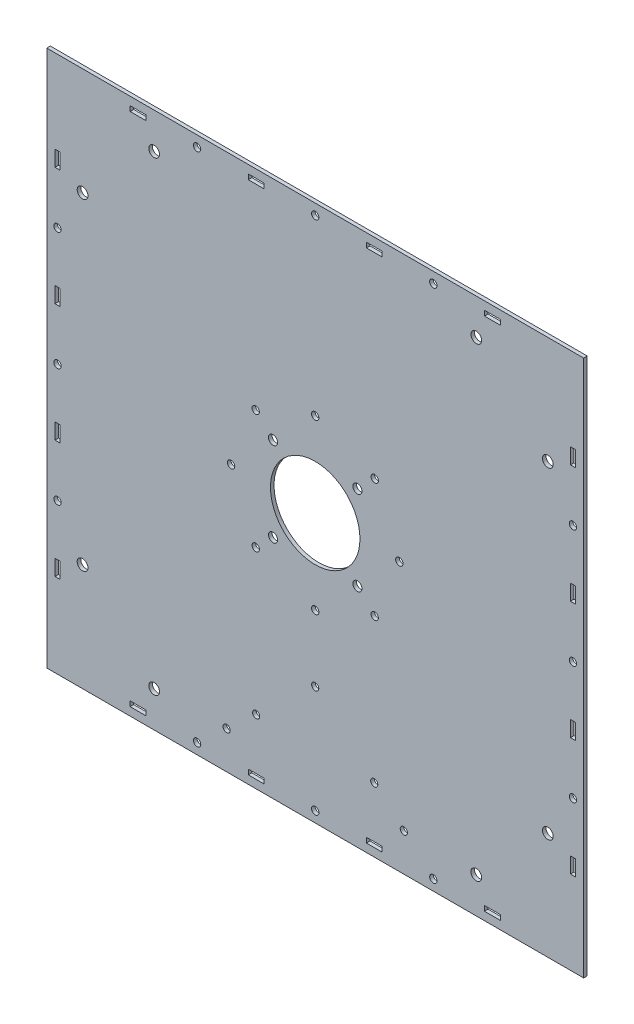
from build123d import *

# Parameters (mm, degrees)
SKETCH_1_R          = 25
SKETCH_1_R_2        = 2.55
EXTRUDE_1_DEPTH     = 2
SKETCH_3_R          = 2.05
SKETCH_3_R_2        = 2
SKETCH_3_W          = 8.8
SKETCH_3_H          = 2.8
SKETCH_3_W_2        = 2.8
SKETCH_3_H_2        = 8.8
CUT_EXTRUDE_2_DEPTH = 4
SKETCH_7_R          = 3
CUT_EXTRUDE_3_DEPTH = 10


with BuildPart() as part:
    # 草图1 → 凸台-拉伸1 (new body)
    with BuildSketch(Plane.XY):
        Polygon((151.457142857, -41.187142857), (151.457142857, 108.812857143), (-148.542857143, 108.812857143), (-148.542857143, -191.187142857), (151.457142857, -191.187142857), align=None)
        with Locations((1.457142857, -41.187142857)):
            Circle(SKETCH_1_R, mode=Mode.SUBTRACT)
        with Locations((25.027142857, -17.617142857)):
            Circle(SKETCH_1_R_2, mode=Mode.SUBTRACT)
        with Locations((25.027142857, -64.757142857)):
            Circle(SKETCH_1_R_2, mode=Mode.SUBTRACT)
        with Locations((-22.112857143, -64.757142857)):
            Circle(SKETCH_1_R_2, mode=Mode.SUBTRACT)
        with Locations((-22.112857143, -17.617142857)):
            Circle(SKETCH_1_R_2, mode=Mode.SUBTRACT)
    extrude(amount=EXTRUDE_1_DEPTH)

    # 草图3 → 切除-拉伸2 (cut)
    with BuildSketch(Plane.XY.offset(2)):
        with Locations((1.457142857, -185.187142857)):
            Circle(SKETCH_3_R)
        with Locations((67.457142857, -185.187142857)):
            Circle(SKETCH_3_R)
        with Locations((-64.542857143, -185.187142857)):
            Circle(SKETCH_3_R)
        with Locations((-142.542857143, 24.812857143)):
            Circle(SKETCH_3_R)
        with Locations((-142.542857143, -41.187142857)):
            Circle(SKETCH_3_R)
        with Locations((-142.542857143, -107.187142857)):
            Circle(SKETCH_3_R)
        with Locations((67.457142857, 102.812857143)):
            Circle(SKETCH_3_R)
        with Locations((1.457142857, 102.812857143)):
            Circle(SKETCH_3_R)
        with Locations((-64.542857143, 102.812857143)):
            Circle(SKETCH_3_R)
        with Locations((145.457142857, -107.187142857)):
            Circle(SKETCH_3_R)
        with Locations((145.457142857, -41.187142857)):
            Circle(SKETCH_3_R)
        with Locations((145.457142857, 24.812857143)):
            Circle(SKETCH_3_R)
        with Locations((50.957142857, -170.187142857)):
            Circle(SKETCH_3_R_2)
        with Locations((-48.042857143, -170.187142857)):
            Circle(SKETCH_3_R_2)
        with Locations((-31.542857143, -155.187142857)):
            Circle(SKETCH_3_R_2)
        with Locations((34.457142857, -155.187142857)):
            Circle(SKETCH_3_R_2)
        with Locations((1.457142857, -88.187142857)):
            Circle(SKETCH_3_R)
        with Locations((-31.776875859, -74.421161573)):
            Circle(SKETCH_3_R)
        with Locations((-45.542857143, -41.187142857)):
            Circle(SKETCH_3_R)
        with Locations((-31.776875859, -7.953124141)):
            Circle(SKETCH_3_R)
        with Locations((1.457142857, 5.812857143)):
            Circle(SKETCH_3_R)
        with Locations((34.691161573, -7.953124141)):
            Circle(SKETCH_3_R)
        with Locations((48.457142857, -41.187142857)):
            Circle(SKETCH_3_R)
        with Locations((34.691161573, -74.421161573)):
            Circle(SKETCH_3_R)
        with Locations((1.457142857, -125.187142857)):
            Circle(SKETCH_3_R_2)
        with Locations((100.457142857, -185.187142857)):
            Rectangle(SKETCH_3_W, SKETCH_3_H)
        with Locations((34.457142857, -185.187142857)):
            Rectangle(SKETCH_3_W, SKETCH_3_H)
        with Locations((-31.542857143, -185.187142857)):
            Rectangle(SKETCH_3_W, SKETCH_3_H)
        with Locations((-97.542857143, -185.187142857)):
            Rectangle(SKETCH_3_W, SKETCH_3_H)
        with Locations((-142.542857143, 57.812857143)):
            Rectangle(SKETCH_3_W_2, SKETCH_3_H_2)
        with Locations((-142.542857143, -8.187142857)):
            Rectangle(SKETCH_3_W_2, SKETCH_3_H_2)
        with Locations((-142.542857143, -74.187142857)):
            Rectangle(SKETCH_3_W_2, SKETCH_3_H_2)
        with Locations((-142.542857143, -140.187142857)):
            Rectangle(SKETCH_3_W_2, SKETCH_3_H_2)
        with Locations((100.457142857, 102.812857143)):
            Rectangle(SKETCH_3_W, SKETCH_3_H)
        with Locations((34.457142857, 102.812857143)):
            Rectangle(SKETCH_3_W, SKETCH_3_H)
        with Locations((-31.542857143, 102.812857143)):
            Rectangle(SKETCH_3_W, SKETCH_3_H)
        with Locations((-97.542857143, 102.812857143)):
            Rectangle(SKETCH_3_W, SKETCH_3_H)
        with Locations((145.457142857, -140.187142857)):
            Rectangle(SKETCH_3_W_2, SKETCH_3_H_2)
        with Locations((145.457142857, -74.187142857)):
            Rectangle(SKETCH_3_W_2, SKETCH_3_H_2)
        with Locations((145.457142857, -8.187142857)):
            Rectangle(SKETCH_3_W_2, SKETCH_3_H_2)
        with Locations((145.457142857, 57.812857143)):
            Rectangle(SKETCH_3_W_2, SKETCH_3_H_2)
    extrude(amount=-CUT_EXTRUDE_2_DEPTH, mode=Mode.SUBTRACT)

    # 草图7 → 切除-拉伸3 (cut)
    with BuildSketch(Plane.XY.offset(2)):
        with Locations((-88.542857143, -171.187142857)):
            Circle(SKETCH_7_R)
        with Locations((91.457142857, -171.187142857)):
            Circle(SKETCH_7_R)
        with Locations((-128.542857143, 48.812857143)):
            Circle(SKETCH_7_R)
        with Locations((-128.542857143, -131.187142857)):
            Circle(SKETCH_7_R)
        with Locations((91.457142857, 88.812857143)):
            Circle(SKETCH_7_R)
        with Locations((-88.542857143, 88.812857143)):
            Circle(SKETCH_7_R)
        with Locations((131.457142857, -131.187142857)):
            Circle(SKETCH_7_R)
        with Locations((131.457142857, 48.812857143)):
            Circle(SKETCH_7_R)
    extrude(amount=-CUT_EXTRUDE_3_DEPTH, mode=Mode.SUBTRACT)


solid = part.part
